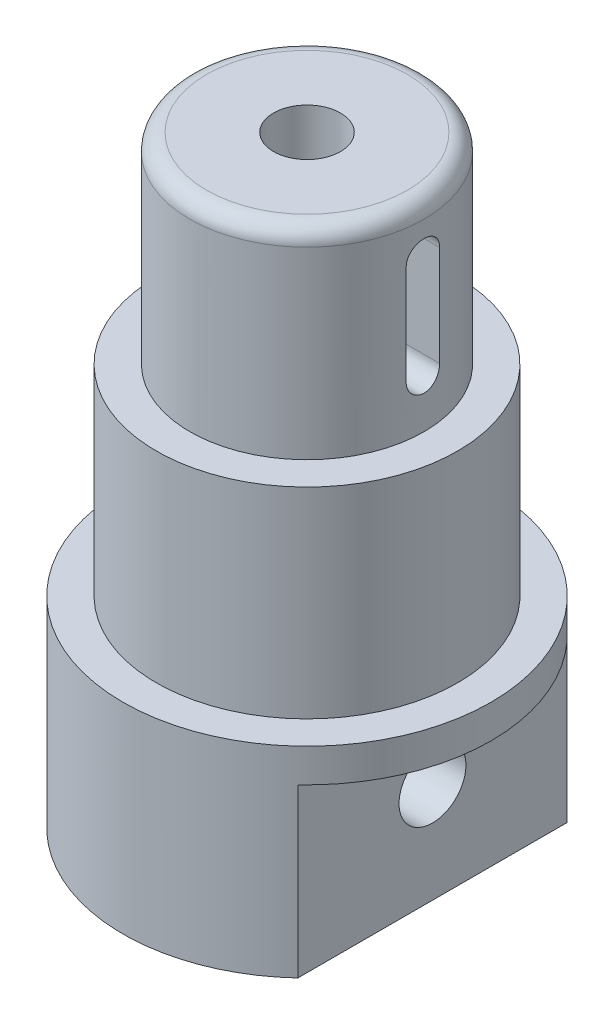
from build123d import *

# Parameters (mm, degrees)
CUT_EXTRUDE1_DEPTH = 20
CUT_EXTRUDE2_START = 9
CUT_EXTRUDE2_DEPTH = 20
HOLE1_D            = 8
FILLET1_R          = 2


with BuildPart() as part:
    # Sketch1 → Revolve1 (revolve)
    with BuildSketch(Plane.XY, mode=Mode.PRIVATE) as revolve1_sk:
        Polygon((4, 0), (4, 72), (14, 72), (14, 48), (18, 48), (18, 24), (22, 24), (22, 0), align=None)
    revolve(revolve1_sk.sketch.rotate(Axis((0, 0, 0), (0, 1, 0)), 90), axis=Axis((0, 0, 0), (0, 1, 0)))

    # Sketch2 → Cut-Extrude1 (cut)
    with BuildSketch(Plane.XZ):
        with BuildLine():
            Line((15, 16.093476939), (15, -16.093476939))
            ThreePointArc((15, -16.093476939), (22, 0), (15, 16.093476939))
        make_face()
    cut_extrude1 = extrude(amount=-CUT_EXTRUDE1_DEPTH, mode=Mode.SUBTRACT)

    # Sketch3 → Cut-Extrude2 (cut)
    with BuildSketch(Plane(origin=(0, 0, 0), x_dir=(0, 0, -1), z_dir=(1, 0, 0)).offset(CUT_EXTRUDE2_START)):
        with BuildLine():
            Line((2, 66), (2, 54))
            ThreePointArc((2, 54), (0, 52), (-2, 54))
            Line((-2, 54), (-2, 66))
            ThreePointArc((-2, 66), (0, 68), (2, 66))
        make_face()
    cut_extrude2 = extrude(amount=CUT_EXTRUDE2_DEPTH, mode=Mode.SUBTRACT)

    # Hole1 (through all)
    with Locations(Plane(origin=(15, 0, 0), x_dir=(0, 0, -1), z_dir=(1, 0, 0))):
        with Locations((0, 12)):
            Hole(HOLE1_D / 2)

    # Mirror2: Cut-Extrude2 across plane
    add(cut_extrude2.mirror(Plane(origin=(0, 0, 0), x_dir=(0, 0, 1), z_dir=(1, 0, 0))), mode=Mode.SUBTRACT)

    # Mirror3: Cut-Extrude1 across plane
    add(cut_extrude1.mirror(Plane(origin=(0, 0, 0), x_dir=(0, 0, 1), z_dir=(1, 0, 0))), mode=Mode.SUBTRACT)

    # Fillet1
    fillet1_edges = [part.edges().sort_by_distance(p)[0] for p in [
        (0, 72, 14),
    ]]
    fillet(fillet1_edges, radius=FILLET1_R)


solid = part.part
